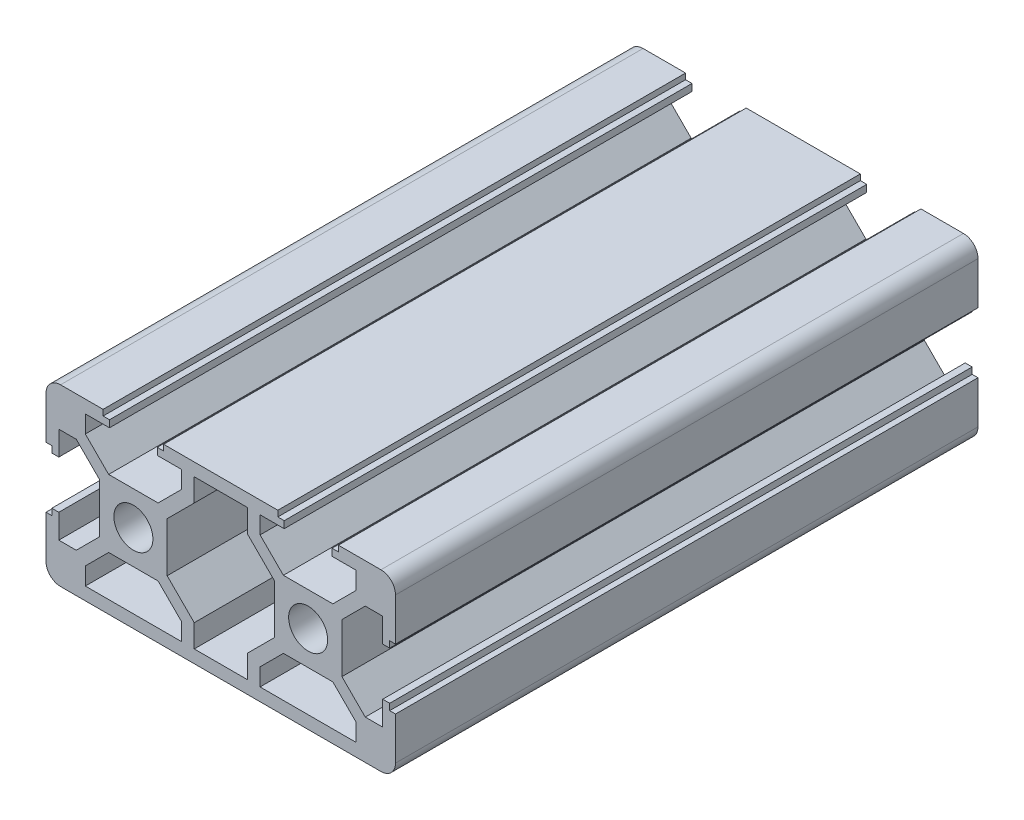
from build123d import *

# Parameters (mm, degrees)
SKETCH_1_R      = 3.35
EXTRUDE_1_DEPTH = 100


with BuildPart() as part:
    # 草图1 → 凸台-拉伸1 (new body)
    with BuildSketch(Plane.XY):
        with BuildLine():
            Line((-5.8, -4.244365081), (-9.805634919, -8.25))
            Line((-9.805634919, -8.25), (-12.8, -8.25))
            Line((-12.8, -8.25), (-12.8, -4.1))
            Line((-12.8, -4.1), (-14, -4.1))
            Line((-14, -4.1), (-14, -5.2))
            Line((-14, -5.2), (-15, -5.2))
            Line((-15, -5.2), (-15, -12.5))
            ThreePointArc((-15, -12.5), (-14.267766953, -14.267766953), (-12.5, -15))
            Line((-12.5, -15), (42.5, -15))
            ThreePointArc((42.5, -15), (44.267766953, -14.267766953), (45, -12.5))
            Line((45, -12.5), (45, -5.2))
            Line((45, -5.2), (44, -5.2))
            Line((44, -5.2), (44, -4.1))
            Line((44, -4.1), (42.8, -4.1))
            Line((42.8, -4.1), (42.8, -8.25))
            Line((42.8, -8.25), (39.805634919, -8.25))
            Line((39.805634919, -8.25), (35.8, -4.244365081))
            Line((35.8, -4.244365081), (35.8, 4.244365081))
            Line((35.8, 4.244365081), (39.805634919, 8.25))
            Line((39.805634919, 8.25), (42.8, 8.25))
            Line((42.8, 8.25), (42.8, 4.1))
            Line((42.8, 4.1), (44, 4.1))
            Line((44, 4.1), (44, 5.2))
            Line((44, 5.2), (45, 5.2))
            Line((45, 5.2), (45, 12.5))
            ThreePointArc((45, 12.5), (44.267766953, 14.267766953), (42.5, 15))
            Line((42.5, 15), (35.2, 15))
            Line((35.2, 15), (35.2, 14))
            Line((35.2, 14), (34.1, 14))
            Line((34.1, 14), (34.1, 12.8))
            Line((34.1, 12.8), (38.25, 12.8))
            Line((38.25, 12.8), (38.25, 9.805634919))
            Line((38.25, 9.805634919), (34.244365081, 5.8))
            Line((34.244365081, 5.8), (25.755634919, 5.8))
            Line((25.755634919, 5.8), (21.75, 9.805634919))
            Line((21.75, 9.805634919), (21.75, 12.8))
            Line((21.75, 12.8), (25.9, 12.8))
            Line((25.9, 12.8), (25.9, 14))
            Line((25.9, 14), (24.8, 14))
            Line((24.8, 14), (24.8, 15))
            Line((24.8, 15), (5.2, 15))
            Line((5.2, 15), (5.2, 14))
            Line((5.2, 14), (4.1, 14))
            Line((4.1, 14), (4.1, 12.8))
            Line((4.1, 12.8), (8.25, 12.8))
            Line((8.25, 12.8), (8.25, 9.805634919))
            Line((8.25, 9.805634919), (4.244365081, 5.8))
            Line((4.244365081, 5.8), (-4.244365081, 5.8))
            Line((-4.244365081, 5.8), (-8.25, 9.805634919))
            Line((-8.25, 9.805634919), (-8.25, 12.8))
            Line((-8.25, 12.8), (-4.1, 12.8))
            Line((-4.1, 12.8), (-4.1, 14))
            Line((-4.1, 14), (-5.2, 14))
            Line((-5.2, 14), (-5.2, 15))
            Line((-5.2, 15), (-12.5, 15))
            ThreePointArc((-12.5, 15), (-14.267766953, 14.267766953), (-15, 12.5))
            Line((-15, 12.5), (-15, 5.2))
            Line((-15, 5.2), (-14, 5.2))
            Line((-14, 5.2), (-14, 4.1))
            Line((-14, 4.1), (-12.8, 4.1))
            Line((-12.8, 4.1), (-12.8, 8.25))
            Line((-12.8, 8.25), (-9.805634919, 8.25))
            Line((-9.805634919, 8.25), (-5.8, 4.244365081))
            Line((-5.8, 4.244365081), (-5.8, -4.244365081))
        make_face()
        with Locations((30, 0)):
            Circle(SKETCH_1_R, mode=Mode.SUBTRACT)
        Circle(SKETCH_1_R, mode=Mode.SUBTRACT)
        Polygon((38.25, -9.805634919), (34.244365081, -5.8), (25.755634919, -5.8), (21.75, -9.805634919), (21.75, -12.8), (38.25, -12.8), align=None, mode=Mode.SUBTRACT)
        Polygon((8.25, -9.805634919), (4.244365081, -5.8), (-4.244365081, -5.8), (-8.25, -9.805634919), (-8.25, -12.8), (8.25, -12.8), align=None, mode=Mode.SUBTRACT)
        Polygon((19.55, 12.8), (10.45, 12.8), (10.45, 8.894365081), (5.8, 4.244365081), (5.8, -4.244365081), (10.45, -8.894365081), (10.45, -12.8), (19.55, -12.8), (19.55, -8.894365081), (24.2, -4.244365081), (24.2, 4.244365081), (19.55, 8.894365081), align=None, mode=Mode.SUBTRACT)
    extrude(amount=EXTRUDE_1_DEPTH)


solid = part.part
